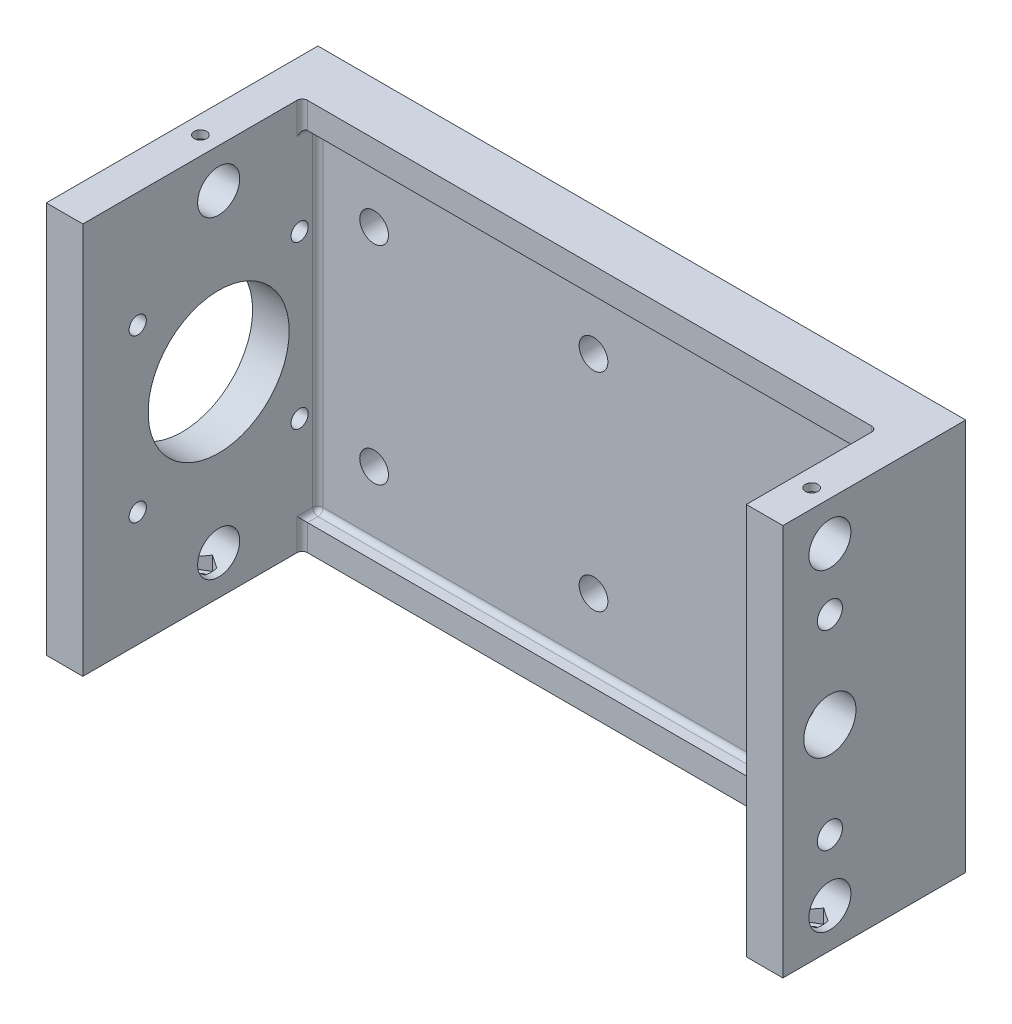
from build123d import *

# Parameters (mm, degrees)
SKETCH1_W            = 110
SKETCH1_H            = 75
BOSS_EXTRUDE1_DEPTH  = 5
SKETCH2_W            = 50.000000309
SKETCH2_H            = 75
BOSS_EXTRUDE2_DEPTH  = 7
SKETCH3_W            = 50.000000309
SKETCH3_H            = 75
BOSS_EXTRUDE3_DEPTH  = 7
SKETCH4_R            = 13.5
CUT_EXTRUDE1_DEPTH   = 133.647088287
SKETCH5_R            = 1.65
CUT_EXTRUDE2_DEPTH   = 7
SKETCH8_R            = 4.025
CUT_EXTRUDE5_DEPTH   = 139.860541663
SKETCH9_W            = 17
SKETCH9_H            = 75
CUT_EXTRUDE6_DEPTH   = 133.647088287
SKETCH13_R           = 2.75
CUT_EXTRUDE7_DEPTH   = 10
SKETCH14_R           = 5
CUT_EXTRUDE8_DEPTH   = 10
BOSS_EXTRUDE4_START  = 2
SKETCH15_W           = 124
SKETCH15_H           = 75
SKETCH15_R           = 2.75
BOSS_EXTRUDE4_DEPTH  = 2
CUT_EXTRUDE11_DEPTH  = 2
MIRROR7_COPY_1_DEPTH = 2
SKETCH20_R           = 2.4
CUT_EXTRUDE12_DEPTH  = 133.647088287
SKETCH21_W           = 110
SKETCH21_H           = 5
BOSS_EXTRUDE5_DEPTH  = 3
FILLET2_R            = 1


with BuildPart() as part:
    # Sketch1 → Boss-Extrude1 (new body)
    with BuildSketch(Plane.XY):
        Rectangle(SKETCH1_W, SKETCH1_H)
    extrude(amount=BOSS_EXTRUDE1_DEPTH)

    # Sketch2 → Boss-Extrude2 (add)
    with BuildSketch(Plane.ZY.offset(55)):
        with Locations((25.000000155, 0)):
            Rectangle(SKETCH2_W, SKETCH2_H)
    extrude(amount=BOSS_EXTRUDE2_DEPTH)

    # Sketch3 → Boss-Extrude3 (add)
    with BuildSketch(Plane(origin=(55, 0, 0), x_dir=(0, 0, -1), z_dir=(1, 0, 0))):
        with Locations((-25.000000155, 0)):
            Rectangle(SKETCH3_W, SKETCH3_H)
    extrude(amount=BOSS_EXTRUDE3_DEPTH)

    # Sketch4 → Cut-Extrude1 (cut, through all)
    with BuildSketch(Plane(origin=(-55, 0, 0), x_dir=(0, 0, -1), z_dir=(1, 0, 0))):
        with Locations((-24, 0)):
            Circle(SKETCH4_R)
    extrude(amount=-CUT_EXTRUDE1_DEPTH, mode=Mode.SUBTRACT)

    # Sketch5 → Cut-Extrude2 (cut)
    with BuildSketch(Plane.ZY.offset(62)):
        with Locations((39.5, 15.5)):
            Circle(SKETCH5_R)
        with Locations((39.5, -15.5)):
            Circle(SKETCH5_R)
        with Locations((8.5, -15.5)):
            Circle(SKETCH5_R)
        with Locations((8.5, 15.5)):
            Circle(SKETCH5_R)
    extrude(amount=-CUT_EXTRUDE2_DEPTH, mode=Mode.SUBTRACT)

    # Sketch8 → Cut-Extrude5 (cut, through all)
    with BuildSketch(Plane.ZY.offset(62)):
        with Locations((24, 30)):
            Circle(SKETCH8_R)
    cut_extrude5 = extrude(amount=-CUT_EXTRUDE5_DEPTH, mode=Mode.SUBTRACT)

    # Mirror1: Cut-Extrude5 across plane
    add(cut_extrude5.mirror(Plane.ZX), mode=Mode.SUBTRACT)

    # Sketch9 → Cut-Extrude6 (cut, through all)
    with BuildSketch(Plane.ZY.offset(-55)):
        with Locations((41.500000309, 0)):
            Rectangle(SKETCH9_W, SKETCH9_H)
    extrude(amount=-CUT_EXTRUDE6_DEPTH, mode=Mode.SUBTRACT)

    # Sketch13 → Cut-Extrude7 (cut)
    with BuildSketch(Plane(origin=(0, 0, 0), x_dir=(-1, 0, 0), z_dir=(0, 0, -1))):
        with Locations((44.25, 19.85)):
            Circle(SKETCH13_R)
        with Locations((2.25, 19.85)):
            Circle(SKETCH13_R)
        with Locations((2.25, -19.85)):
            Circle(SKETCH13_R)
        with Locations((44.25, -19.85)):
            Circle(SKETCH13_R)
    extrude(amount=-CUT_EXTRUDE7_DEPTH, mode=Mode.SUBTRACT)

    # Sketch14 → Cut-Extrude8 (cut)
    with BuildSketch(Plane.ZY.offset(-55)):
        with Locations((24, 0)):
            Circle(SKETCH14_R)
    extrude(amount=-CUT_EXTRUDE8_DEPTH, mode=Mode.SUBTRACT)

    # Sketch15 → Boss-Extrude4 (add)
    with BuildSketch(Plane(origin=(0, 0, 0), x_dir=(-1, 0, 0), z_dir=(0, 0, -1)).offset(BOSS_EXTRUDE4_START)):
        Rectangle(SKETCH15_W, SKETCH15_H)
        with Locations((44.25, 19.85)):
            Circle(SKETCH15_R, mode=Mode.SUBTRACT)
        with Locations((2.25, 19.85)):
            Circle(SKETCH15_R, mode=Mode.SUBTRACT)
        with Locations((2.25, -19.85)):
            Circle(SKETCH15_R, mode=Mode.SUBTRACT)
        with Locations((44.25, -19.85)):
            Circle(SKETCH15_R, mode=Mode.SUBTRACT)
    extrude(amount=-BOSS_EXTRUDE4_DEPTH)

    # Sketch16 → Cut-Extrude11 (cut, symmetric)
    with BuildSketch(Plane(origin=(0, -34.025, 0), x_dir=(1, 0, 0), z_dir=(0, 1, 0))):
        Polygon((58.5, -26.309401386), (60.5, -25.154700847), (60.5, -22.845299771), (58.5, -21.690599232), (56.5, -22.845299771), (56.5, -25.154700847), align=None)
    cut_extrude11 = extrude(amount=CUT_EXTRUDE11_DEPTH, both=True, mode=Mode.SUBTRACT)

    # Sketch18 → Dégagement M21 (revolve, cut)
    with BuildSketch(Plane(origin=(58.5, -37.5, 24.000000309), x_dir=(0, 0, -1), z_dir=(1, 0, 0))):
        Polygon((0, 0), (0, 5.721032743), (1.2, 5), (1.2, 0), align=None)
    d_gagement_m21 = revolve(axis=Axis((58.5, -43.85, 24.000000309), (0, 1, 0)), mode=Mode.SUBTRACT)

    # Mirror5: Cut-Extrude11, Dégagement M21 across plane
    add(cut_extrude11.mirror(Plane(origin=(0, 0, 0), x_dir=(0, 0, 1), z_dir=(1, 0, 0))), mode=Mode.SUBTRACT)
    add(d_gagement_m21.mirror(Plane(origin=(0, 0, 0), x_dir=(0, 0, 1), z_dir=(1, 0, 0))), mode=Mode.SUBTRACT)

    # Mirror7: Cut-Extrude11, Dégagement M21 across plane
    add(cut_extrude11.mirror(Plane.ZX), mode=Mode.SUBTRACT)
    add(d_gagement_m21.mirror(Plane.ZX), mode=Mode.SUBTRACT)

    # Mirror7 copy 1 sketch → Mirror7 copy 1 (cut, symmetric)
    with BuildSketch(Plane(origin=(0, 34.025, 0), x_dir=(-1, 0, 0), z_dir=(0, -1, 0))):
        Polygon((58.5, -26.309401386), (60.5, -25.154700847), (60.5, -22.845299771), (58.5, -21.690599232), (56.5, -22.845299771), (56.5, -25.154700847), align=None)
    extrude(amount=MIRROR7_COPY_1_DEPTH, both=True, mode=Mode.SUBTRACT)

    # Mirror7 copy 2 sketch → Mirror7 copy 2 (revolve, cut)
    with BuildSketch(Plane(origin=(-58.5, 37.5, 24.000000309), x_dir=(0, 0, -1), z_dir=(-1, 0, 0))):
        Polygon((0, 0), (0, 5.721032743), (1.2, 5), (1.2, 0), align=None)
    revolve(axis=Axis((-58.5, 43.85, 24.000000309), (0, -1, 0)), mode=Mode.SUBTRACT)

    # Sketch20 → Cut-Extrude12 (cut, through all)
    with BuildSketch(Plane.ZY.offset(-55)):
        with Locations((24, 18.25)):
            Circle(SKETCH20_R)
        with Locations((24, -18.25)):
            Circle(SKETCH20_R)
    extrude(amount=-CUT_EXTRUDE12_DEPTH, mode=Mode.SUBTRACT)

    # Sketch21 → Boss-Extrude5 (add)
    with BuildSketch(Plane.XY.offset(5)):
        with Locations((0, 35)):
            Rectangle(SKETCH21_W, SKETCH21_H)
        with Locations((0, -35)):
            Rectangle(SKETCH21_W, SKETCH21_H)
    extrude(amount=BOSS_EXTRUDE5_DEPTH)

    # Fillet2
    fillet2_edges = [part.edges().sort_by_distance(p)[0] for p in [
        (55, 0, 5),
        (-55, 0, 5),
        (55, 32.5, 6.5),
        (0, 32.5, 5),
        (-55, 32.5, 6.5),
        (55, 35, 8),
        (-55, 35, 8),
        (-55, -32.5, 6.5),
        (0, -32.5, 5),
        (55, -32.5, 6.5),
        (-55, -35, 8),
        (55, -35, 8),
    ]]
    fillet(fillet2_edges, radius=FILLET2_R)


solid = part.part
